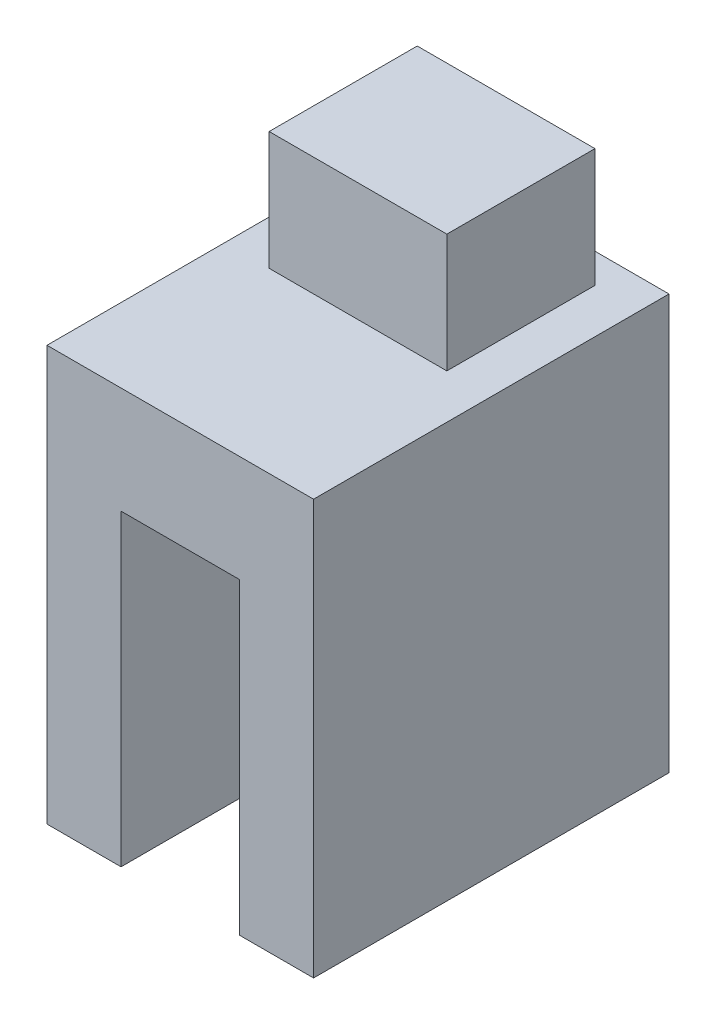
from build123d import *

# Parameters (mm, degrees)
SKETCH3_W           = 14.2875
SKETCH3_H           = 19.05
BOSS_EXTRUDE1_DEPTH = 22.225
SKETCH4_W           = 9.525
SKETCH4_H           = 7.9375
BOSS_EXTRUDE2_DEPTH = 6.35
SKETCH5_W           = 6.35
SKETCH5_H           = 19.05
CUT_EXTRUDE1_DEPTH  = 16.51


with BuildPart() as part:
    # Sketch3 → Boss-Extrude1 (new body)
    with BuildSketch(Plane(origin=(0, 0, 0), x_dir=(1, 0, 0), z_dir=(0, 1, 0))):
        Rectangle(SKETCH3_W, SKETCH3_H)
    extrude(amount=BOSS_EXTRUDE1_DEPTH)

    # Sketch4 → Boss-Extrude2 (add)
    with BuildSketch(Plane(origin=(0, 22.225, 0), x_dir=(1, 0, 0), z_dir=(0, 1, 0))):
        with Locations((0, 3.96875)):
            Rectangle(SKETCH4_W, SKETCH4_H)
    extrude(amount=BOSS_EXTRUDE2_DEPTH)

    # Sketch5 → Cut-Extrude1 (cut)
    with BuildSketch(Plane.XZ):
        Rectangle(SKETCH5_W, SKETCH5_H)
    extrude(amount=-CUT_EXTRUDE1_DEPTH, mode=Mode.SUBTRACT)


solid = part.part
